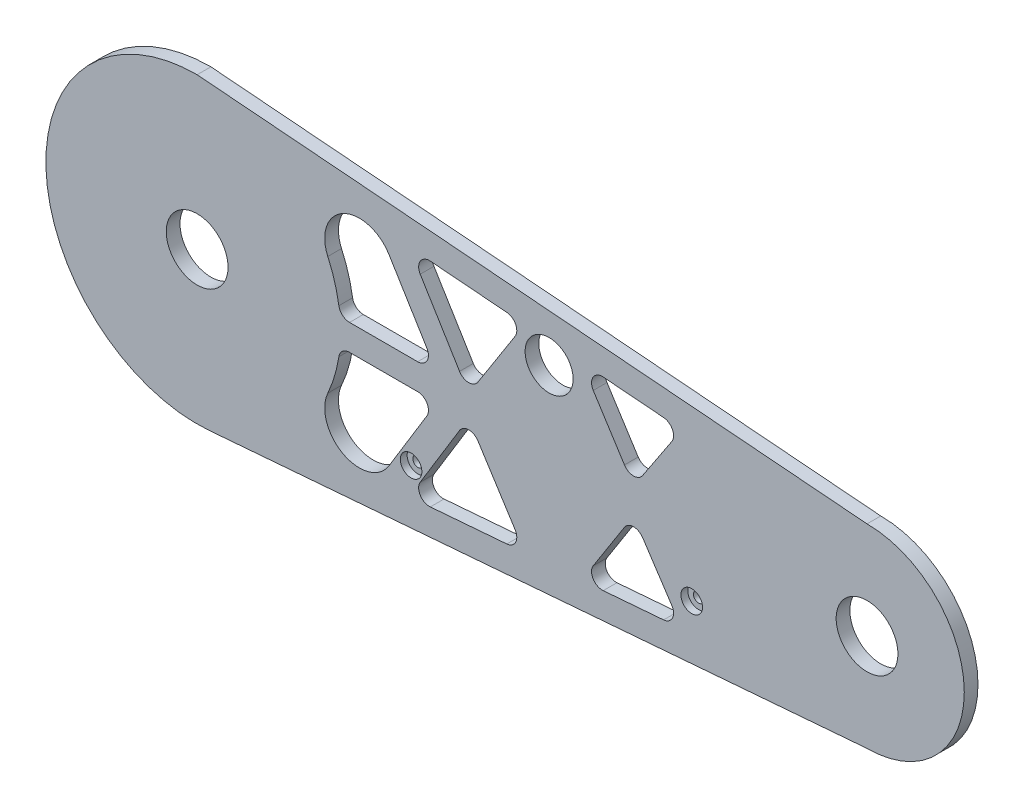
from build123d import *

# Parameters (mm, degrees)
SKETCH1_R             = 14.29385
SKETCH1_R_2           = 11.1125
BOSS_EXTRUDE1_DEPTH   = 6.35
CROQUIS1_R            = 2.38125
CORTAR_EXTRUIR1_DEPTH = 50
CROQUIS2_R            = 5
CORTAR_EXTRUIR2_DEPTH = 3.175


with BuildPart() as part:
    # Sketch1 → Boss-Extrude1 (new body)
    with BuildSketch(Plane.XY):
        with BuildLine():
            Line((0, 70), (310, 45))
            ThreePointArc((310, 45), (355, 0), (310, -45))
            Line((310, -45), (5.171398252, -69.808714643))
            ThreePointArc((5.171398252, -69.808714643), (-69.952162315, -2.587467389), (0, 70))
        make_face()
        Circle(SKETCH1_R, mode=Mode.SUBTRACT)
        with Locations((310, 0)):
            Circle(SKETCH1_R, mode=Mode.SUBTRACT)
        with Locations((162.878542763, 35)):
            Circle(SKETCH1_R_2, mode=Mode.SUBTRACT)
        with BuildLine():
            Line((107.898974887, 49.259511156), (143.314248041, 46.40344074))
            ThreePointArc((143.314248041, 46.40344074), (147.389908855, 43.644764005), (147.127454118, 38.730252238))
            Line((147.127454118, 38.730252238), (129.916226305, 11.754586611))
            ThreePointArc((129.916226305, 11.754586611), (125.651076231, 9.444205574), (121.433006579, 11.839462159))
            Line((121.433006579, 11.839462159), (103.228961238, 41.671198203))
            ThreePointArc((103.228961238, 41.671198203), (103.238833139, 46.896293531), (107.898974887, 49.259511156))
        make_face(mode=Mode.SUBTRACT)
        with BuildLine():
            Line((70.523244027, 6), (102.03004784, 6))
            ThreePointArc((102.03004784, 6), (106.3902351, 8.552804247), (106.298140539, 13.604493178))
            Line((106.298140539, 13.604493178), (88.746497295, 42.367110417))
            ThreePointArc((88.746497295, 42.367110417), (67.562092561, 48.186702797), (60.457600585, 27.397935321))
            ThreePointArc((60.457600585, 27.397935321), (63.602250375, 18.987418874), (65.58297828, 10.229432452))
            ThreePointArc((65.58297828, 10.229432452), (67.271539685, 7.201787411), (70.523244027, 6))
        make_face(mode=Mode.SUBTRACT)
        with BuildLine():
            Line((219.623774494, 32.810522613), (206.130928429, 12.417497436))
            ThreePointArc((206.130928429, 12.417497436), (201.919524559, 10.176643248), (197.745901529, 12.48710226))
            Line((197.745901529, 12.48710226), (183.296864227, 35.133505128))
            ThreePointArc((183.296864227, 35.133505128), (183.227765467, 40.400743015), (187.913912204, 42.80669363))
            Line((187.913912204, 42.80669363), (215.855795571, 40.553315939))
            ThreePointArc((215.855795571, 40.553315939), (219.949772588, 37.757395035), (219.623774494, 32.810522613))
        make_face(mode=Mode.SUBTRACT)
        with BuildLine():
            Line((88.746497295, -42.367110417), (106.298140539, -13.604493178))
            ThreePointArc((106.298140539, -13.604493178), (106.3902351, -8.552804247), (102.03004784, -6))
            Line((102.03004784, -6), (70.523244027, -6))
            ThreePointArc((70.523244027, -6), (67.271539685, -7.201787411), (65.58297828, -10.229432452))
            ThreePointArc((65.58297828, -10.229432452), (63.602250375, -18.987418874), (60.457600585, -27.397935321))
            ThreePointArc((60.457600585, -27.397935321), (67.562092561, -48.186702797), (88.746497295, -42.367110417))
        make_face(mode=Mode.SUBTRACT)
        with BuildLine():
            Line((187.913912204, -42.80669363), (215.855795571, -40.553315939))
            ThreePointArc((215.855795571, -40.553315939), (219.949772588, -37.757395035), (219.623774494, -32.810522613))
            Line((219.623774494, -32.810522613), (206.130928429, -12.417497436))
            ThreePointArc((206.130928429, -12.417497436), (201.919524559, -10.176643248), (197.745901529, -12.48710226))
            Line((197.745901529, -12.48710226), (183.296864227, -35.133505128))
            ThreePointArc((183.296864227, -35.133505128), (183.227765467, -40.400743015), (187.913912204, -42.80669363))
        make_face(mode=Mode.SUBTRACT)
        with BuildLine():
            Line((121.433006579, -11.839462159), (103.228961238, -41.671198203))
            ThreePointArc((103.228961238, -41.671198203), (103.238833139, -46.896293531), (107.898974887, -49.259511156))
            Line((107.898974887, -49.259511156), (143.314248041, -46.40344074))
            ThreePointArc((143.314248041, -46.40344074), (147.389908855, -43.644764005), (147.127454118, -38.730252238))
            Line((147.127454118, -38.730252238), (129.916226305, -11.754586611))
            ThreePointArc((129.916226305, -11.754586611), (125.651076231, -9.444205574), (121.433006579, -11.839462159))
        make_face(mode=Mode.SUBTRACT)
    extrude(amount=BOSS_EXTRUDE1_DEPTH)

    # Croquis1 → Cortar-Extruir1 (cut)
    with BuildSketch(Plane.XY.offset(6.35)):
        with Locations((98.995555235, -37.090103176)):
            Circle(CROQUIS1_R)
        with Locations((228.877351461, -26.519571404)):
            Circle(CROQUIS1_R)
    extrude(amount=-CORTAR_EXTRUIR1_DEPTH, mode=Mode.SUBTRACT)

    # Croquis2 → Cortar-Extruir2 (cut)
    with BuildSketch(Plane.XY.offset(6.35)):
        with Locations((98.995555235, -37.090103176)):
            Circle(CROQUIS2_R)
        with Locations((228.877351461, -26.519571404)):
            Circle(CROQUIS2_R)
    extrude(amount=-CORTAR_EXTRUIR2_DEPTH, mode=Mode.SUBTRACT)


solid = part.part
